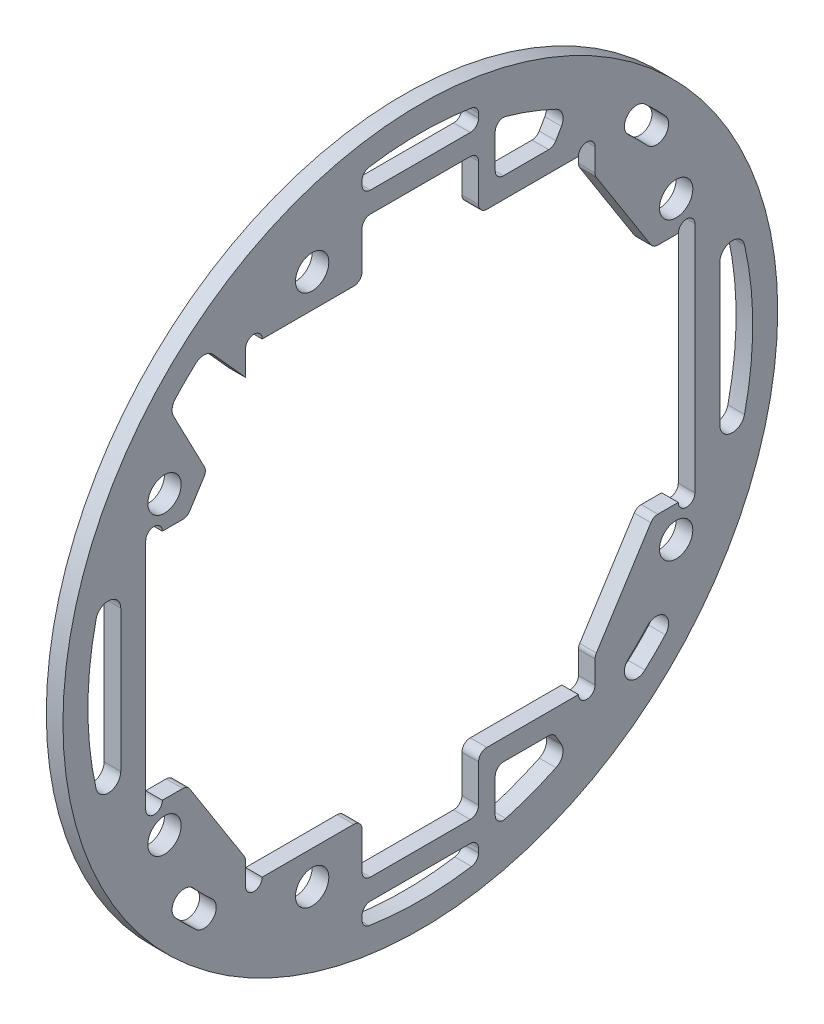
from build123d import *

# Parameters (mm, degrees)
SKETCH_1_R          = 42.95
SKETCH_1_R_2        = 2
EXTRUDE_1_DEPTH     = 2
SKETCH_5_R          = 1
SKETCH_5_R_2        = 2
SKETCH_5_W          = 14
SKETCH_5_H          = 6.5
CUT_EXTRUDE_2_DEPTH = 61.773390559
CUT_EXTRUDE_3_DEPTH = 61.773390559
FILLET_1_R          = 1


with BuildPart() as part:
    # 草图1 → 凸台-拉伸1 (new body)
    with BuildSketch(Plane(origin=(0, 0, 0), x_dir=(0, 0, -1), z_dir=(1, 0, 0))):
        Circle(SKETCH_1_R)
        with Locations((-30.743901834, 17.75)):
            Circle(SKETCH_1_R_2, mode=Mode.SUBTRACT)
        with Locations(Location((-30.743901834, -17.75, 0), (0, 0, 180))):
            Circle(SKETCH_1_R_2, mode=Mode.SUBTRACT)
        with Locations((30.743901834, -17.75)):
            Circle(SKETCH_1_R_2, mode=Mode.SUBTRACT)
        with Locations(Location((30.743901834, 17.75, 0), (0, 0, 180))):
            Circle(SKETCH_1_R_2, mode=Mode.SUBTRACT)
        Polygon((-21, 28), (21, 28), (21, 25), (28, 14), (33, 14), (33, -14), (28, -14), (21, -25), (21, -28), (-21, -28), (-21, -25), (-28, -14), (-33, -14), (-33, 14), (-28, 14), (-21, 25), align=None, mode=Mode.SUBTRACT)
    extrude(amount=EXTRUDE_1_DEPTH)

    # 草图5 → 切除-拉伸2 (cut, through all)
    with BuildSketch(Plane(origin=(2, 0, 0), x_dir=(0, 0, -1), z_dir=(1, 0, 0))):
        with Locations((32, 14)):
            Circle(SKETCH_5_R)
        with Locations((20, 28)):
            Circle(SKETCH_5_R)
        with Locations((-20, 28)):
            Circle(SKETCH_5_R)
        with Locations((-32, 14)):
            Circle(SKETCH_5_R)
        with Locations((-32, -14)):
            Circle(SKETCH_5_R)
        with Locations((-20, -28)):
            Circle(SKETCH_5_R)
        with Locations((20, -28)):
            Circle(SKETCH_5_R)
        with Locations((32, -14)):
            Circle(SKETCH_5_R)
        with Locations((-13, 32)):
            Circle(SKETCH_5_R_2)
        with Locations(Location((-13, -32, 0), (0, 0, 180))):
            Circle(SKETCH_5_R_2)
        with BuildLine():
            Line((-36, 8.49426277), (-36, -8.49426277))
            ThreePointArc((-36, -8.49426277), (-37.333279159, -9.984968697), (-38.962938882, -8.82563843))
            ThreePointArc((-38.962938882, -8.82563843), (-39.95, 0), (-38.962938882, 8.82563843))
            ThreePointArc((-38.962938882, 8.82563843), (-37.333279159, 9.984968697), (-36, 8.49426277))
        make_face()
        with Locations((0, 31.25)):
            Rectangle(SKETCH_5_W, SKETCH_5_H)
        with BuildLine():
            Line((-7, 39.331952659), (-7, 37))
            Line((-7, 37), (7, 37))
            Line((7, 37), (7, 39.331952659))
            ThreePointArc((7, 39.331952659), (0, 39.95), (-7, 39.331952659))
        make_face()
        with BuildLine():
            Line((9, 30.5), (9, 36.867363616))
            ThreePointArc((9, 36.867363616), (12.719592996, 35.754922095), (16.306065038, 34.268276043))
            ThreePointArc((16.306065038, 34.268276043), (17.093879667, 33.359276514), (16.960594644, 32.163798729))
            Line((16.960594644, 32.163798729), (16, 30.5))
            Line((16, 30.5), (9, 30.5))
        make_face()
        with BuildLine():
            Line((36, 8.49426277), (36, -8.49426277))
            ThreePointArc((36, -8.49426277), (37.333279159, -9.984968697), (38.962938882, -8.82563843))
            ThreePointArc((38.962938882, -8.82563843), (39.95, 0), (38.962938882, 8.82563843))
            ThreePointArc((38.962938882, 8.82563843), (37.333279159, 9.984968697), (36, 8.49426277))
        make_face()
        with Locations((0, -31.25)):
            Rectangle(SKETCH_5_W, SKETCH_5_H)
        with BuildLine():
            Line((16, -30.5), (9, -30.5))
            Line((9, -30.5), (9, -36.867363616))
            ThreePointArc((9, -36.867363616), (12.719592996, -35.754922095), (16.306065038, -34.268276043))
            ThreePointArc((16.306065038, -34.268276043), (17.093879667, -33.359276514), (16.960594644, -32.163798729))
            Line((16.960594644, -32.163798729), (16, -30.5))
        make_face()
        with BuildLine():
            Line((7, -39.331952659), (7, -37))
            Line((7, -37), (-7, -37))
            Line((-7, -37), (-7, -39.331952659))
            ThreePointArc((-7, -39.331952659), (0, -39.95), (7, -39.331952659))
        make_face()
        with BuildLine():
            ThreePointArc((-26.996751137, 29.44788495), (-28.248915908, 28.248915908), (-29.44788495, 26.996751137))
            ThreePointArc((-29.44788495, 26.996751137), (-29.357386268, 24.91275018), (-27.273385311, 25.003248863))
            ThreePointArc((-27.273385311, 25.003248863), (-26.162950904, 26.162950904), (-25.003248863, 27.273385311))
            ThreePointArc((-25.003248863, 27.273385311), (-24.91275018, 29.357386268), (-26.996751137, 29.44788495))
        make_face()
        with BuildLine():
            ThreePointArc((26.996751137, 29.44788495), (28.248915908, 28.248915908), (29.44788495, 26.996751137))
            ThreePointArc((29.44788495, 26.996751137), (29.357386268, 24.91275018), (27.273385311, 25.003248863))
            ThreePointArc((27.273385311, 25.003248863), (26.162950904, 26.162950904), (25.003248863, 27.273385311))
            ThreePointArc((25.003248863, 27.273385311), (24.91275018, 29.357386268), (26.996751137, 29.44788495))
        make_face()
        with BuildLine():
            ThreePointArc((26.996751137, -29.44788495), (28.248915908, -28.248915908), (29.44788495, -26.996751137))
            ThreePointArc((29.44788495, -26.996751137), (29.357386268, -24.91275018), (27.273385311, -25.003248863))
            ThreePointArc((27.273385311, -25.003248863), (26.162950904, -26.162950904), (25.003248863, -27.273385311))
            ThreePointArc((25.003248863, -27.273385311), (24.91275018, -29.357386268), (26.996751137, -29.44788495))
        make_face()
        with BuildLine():
            ThreePointArc((-26.996751137, -29.44788495), (-28.248915908, -28.248915908), (-29.44788495, -26.996751137))
            ThreePointArc((-29.44788495, -26.996751137), (-29.357386268, -24.91275018), (-27.273385311, -25.003248863))
            ThreePointArc((-27.273385311, -25.003248863), (-26.162950904, -26.162950904), (-25.003248863, -27.273385311))
            ThreePointArc((-25.003248863, -27.273385311), (-24.91275018, -29.357386268), (-26.996751137, -29.44788495))
        make_face()
    extrude(amount=-CUT_EXTRUDE_2_DEPTH, mode=Mode.SUBTRACT)

    # 草图6 → 切除-拉伸3 (cut, through all)
    with BuildSketch(Plane(origin=(2, 0, 0), x_dir=(0, 0, -1), z_dir=(1, 0, 0))):
        Polygon((-29.668633505, 25.318263062), (-25.674311866, 17.654652782), (-21, 25), (-24.902514308, 29.346104641), align=None)
    extrude(amount=-CUT_EXTRUDE_3_DEPTH, mode=Mode.SUBTRACT)

    # 圆角1
    fillet_1_edges = [part.edges().sort_by_distance(p)[0] for p in [
        (1, -36.867363616, -9),
        (1, -30.5, -9),
        (1, -30.5, -16),
        (1, -39.331952659, -7),
        (1, -39.331952659, 7),
        (1, -37, 7),
        (1, -37, -7),
        (1, -14, 28),
        (1, -25, 21),
        (1, 30.5, -16),
        (1, -25, -21),
        (1, 30.5, -9),
        (1, 36.867363616, -9),
        (1, -14, -28),
        (1, 34.5, -7),
        (1, 28, -7),
        (1, 28, 7),
        (1, 34.5, 7),
        (1, 14, -28),
        (1, 25, -21),
        (1, 39.331952659, 7),
        (1, 39.331952659, -7),
        (1, 37, -7),
        (1, 37, 7),
        (1, 14, 28),
        (1, -34.5, 7),
        (1, -28, 7),
        (1, -28, -7),
        (1, -34.5, -7),
        (1, 17.654652782, 25.674311866),
    ]]
    fillet(fillet_1_edges, radius=FILLET_1_R)


solid = part.part
